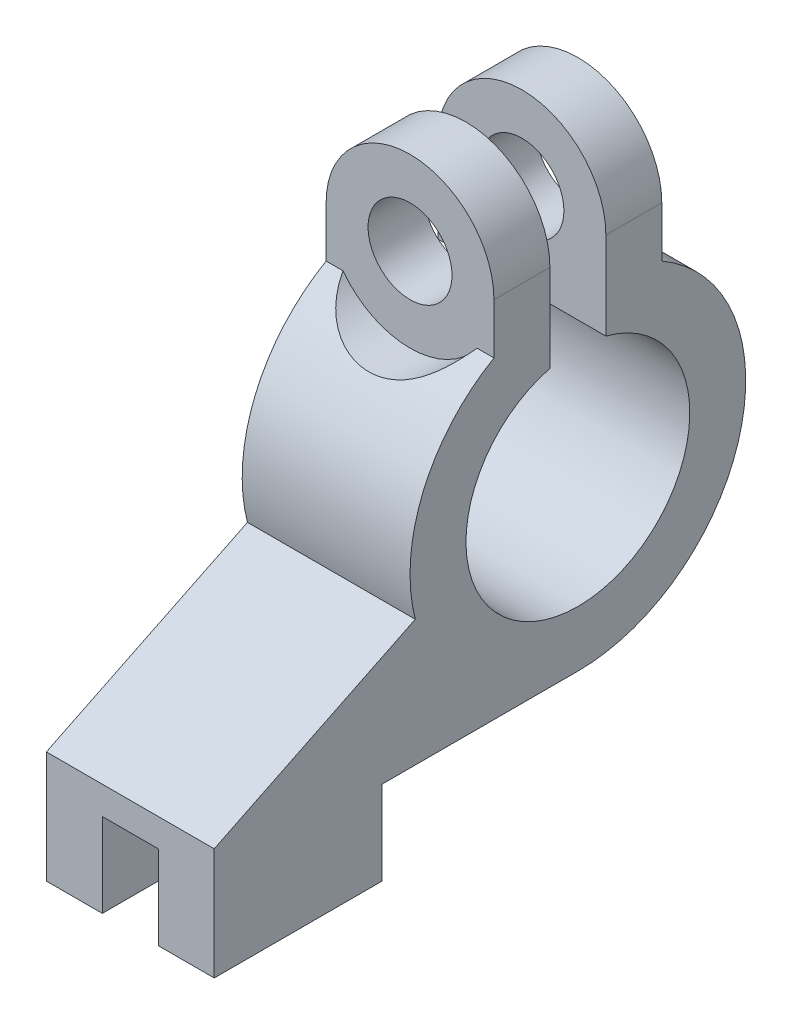
from build123d import *

# Parameters (mm, degrees)
SKETCH1_W           = 30
SKETCH1_H           = 15
BOSS_EXTRUDE1_DEPTH = 30
CUT_EXTRUDE1_DEPTH  = 15
SKETCH4_3_R         = 7.5
CUT_EXTRUDE2_DEPTH  = 15
CUT_EXTRUDE3_START  = 35
SKETCH4_4_R         = 15
SKETCH4_4_R_2       = 7.5
CUT_EXTRUDE3_DEPTH  = 20
CUT_EXTRUDE4_START  = -15
SKETCH4_5_R         = 15
SKETCH4_5_R_2       = 7.5
CUT_EXTRUDE4_DEPTH  = 20
CUT_EXTRUDE5_START  = 10
SKETCH1_3_W         = 30
SKETCH1_3_H         = 15
CUT_EXTRUDE5_DEPTH  = 10


with BuildPart() as part:
    # Sketch1 → Boss-Extrude1 (new body)
    with BuildSketch(Plane(origin=(0, 0, 0), x_dir=(0, 0, -1), z_dir=(1, 0, 0))):
        with BuildLine():
            Line((0, -30), (-65, -30))
            Line((-65, -30), (-65, -25))
            Line((-65, -25), (-29.063054532, -7.439009429))
            ThreePointArc((-29.063054532, -7.439009429), (-27.651554679, 11.635786344), (-15, 25.980762114))
            Line((-15, 25.980762114), (-15, 50))
            Line((-15, 50), (-5, 50))
            Line((-5, 50), (-5, 19.364916731))
            ThreePointArc((-5, 19.364916731), (0, -20), (5, 19.364916731))
            Line((5, 19.364916731), (5, 50))
            Line((5, 50), (15, 50))
            Line((15, 50), (15, 25.980762114))
            ThreePointArc((15, 25.980762114), (28.977774789, -7.764571353), (0, -30))
        make_face()
        with Locations((-50, -37.5)):
            Rectangle(SKETCH1_W, SKETCH1_H)
    extrude(amount=BOSS_EXTRUDE1_DEPTH)

    # Sketch4 → Cut-Extrude1 (cut, symmetric)
    with BuildSketch(Plane.XY):
        with BuildLine():
            ThreePointArc((0, 35), (4.393398282, 45.606601718), (15, 50))
            Line((15, 50), (0, 50))
            Line((0, 50), (0, 35))
        make_face()
        with BuildLine():
            Line((30, 50), (15, 50))
            ThreePointArc((15, 50), (25.606601718, 45.606601718), (30, 35))
            Line((30, 35), (30, 50))
        make_face()
    extrude(amount=CUT_EXTRUDE1_DEPTH, both=True, mode=Mode.SUBTRACT)

    # Sketch4<3> → Cut-Extrude2 (cut, symmetric)
    with BuildSketch(Plane.XY):
        with Locations((15, 35)):
            Circle(SKETCH4_3_R)
    extrude(amount=CUT_EXTRUDE2_DEPTH, both=True, mode=Mode.SUBTRACT)

    # Sketch4<4> → Cut-Extrude3 (cut)
    with BuildSketch(Plane.XY.offset(CUT_EXTRUDE3_START)):
        with Locations((15, 35)):
            Circle(SKETCH4_4_R)
        with Locations((15, 35)):
            Circle(SKETCH4_4_R_2, mode=Mode.SUBTRACT)
    extrude(amount=-CUT_EXTRUDE3_DEPTH, mode=Mode.SUBTRACT)

    # Sketch4<5> → Cut-Extrude4 (cut)
    with BuildSketch(Plane.XY.offset(CUT_EXTRUDE4_START)):
        with Locations((15, 35)):
            Circle(SKETCH4_5_R)
        with Locations((15, 35)):
            Circle(SKETCH4_5_R_2, mode=Mode.SUBTRACT)
    extrude(amount=-CUT_EXTRUDE4_DEPTH, mode=Mode.SUBTRACT)

    # Sketch1<3> → Cut-Extrude5 (cut)
    with BuildSketch(Plane(origin=(0, 0, 0), x_dir=(0, 0, -1), z_dir=(1, 0, 0)).offset(CUT_EXTRUDE5_START)):
        with Locations((-50, -37.5)):
            Rectangle(SKETCH1_3_W, SKETCH1_3_H)
    extrude(amount=CUT_EXTRUDE5_DEPTH, mode=Mode.SUBTRACT)


solid = part.part
